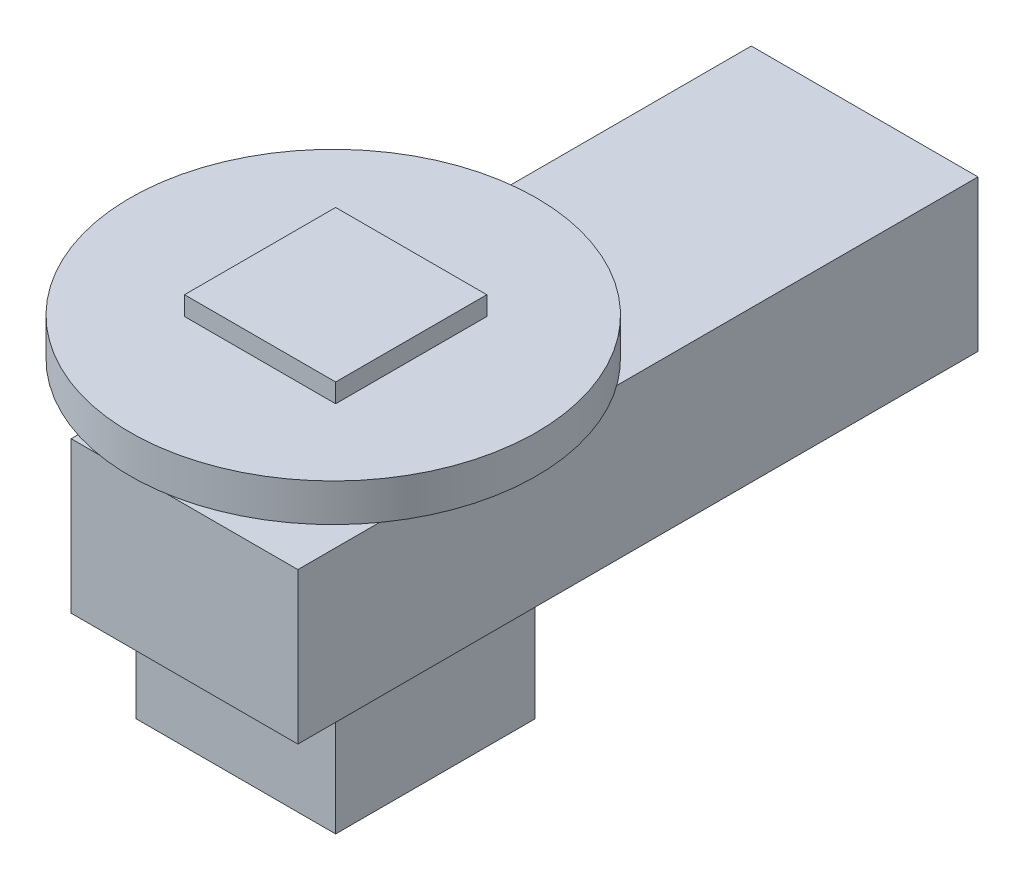
from build123d import *

# Parameters (mm, degrees)
SKETCH1_W           = 38.1
SKETCH1_H           = 25.4
BOSS_EXTRUDE1_DEPTH = 114.3
SKETCH3_W           = 33.528
SKETCH3_H           = 33.528
BOSS_EXTRUDE2_DEPTH = 18.542
SKETCH2_R           = 6.35
BOSS_EXTRUDE3_DEPTH = 17.78
SKETCH4_W           = 25.4
SKETCH4_H           = 25.4
BOSS_EXTRUDE4_DEPTH = 6.35
SKETCH5_R           = 34.1376
BOSS_EXTRUDE5_DEPTH = 3.175


with BuildPart() as part:
    # Sketch1 → Boss-Extrude1 (new body)
    with BuildSketch(Plane.XY):
        with Locations((-19.05, 12.7)):
            Rectangle(SKETCH1_W, SKETCH1_H)
    extrude(amount=BOSS_EXTRUDE1_DEPTH)

    # Sketch3 → Boss-Extrude2 (add)
    with BuildSketch(Plane.XZ):
        with Locations((-19.05, 88.9)):
            Rectangle(SKETCH3_W, SKETCH3_H)
    extrude(amount=BOSS_EXTRUDE2_DEPTH)

    # Sketch2 → Boss-Extrude3 (add)
    with BuildSketch(Plane(origin=(0, 25.4, 0), x_dir=(1, 0, 0), z_dir=(0, 1, 0))):
        with Locations(Location((-19.05, -88.9, 0), (0, 0, 90))):
            Circle(SKETCH2_R)
    extrude(amount=BOSS_EXTRUDE3_DEPTH)

    # Sketch4 → Boss-Extrude4 (add)
    with BuildSketch(Plane(origin=(0, 43.18, 0), x_dir=(1, 0, 0), z_dir=(0, 1, 0))):
        with Locations((-19.05, -88.9)):
            Rectangle(SKETCH4_W, SKETCH4_H)
    extrude(amount=-BOSS_EXTRUDE4_DEPTH)

    # Sketch5 → Boss-Extrude5 (add, symmetric)
    with BuildSketch(Plane.XZ.offset(-36.83)):
        with Locations(Location((-19.450692706, 88.9, 0), (0, 0, 270))):
            Circle(SKETCH5_R)
    extrude(amount=BOSS_EXTRUDE5_DEPTH, both=True)


solid = part.part
